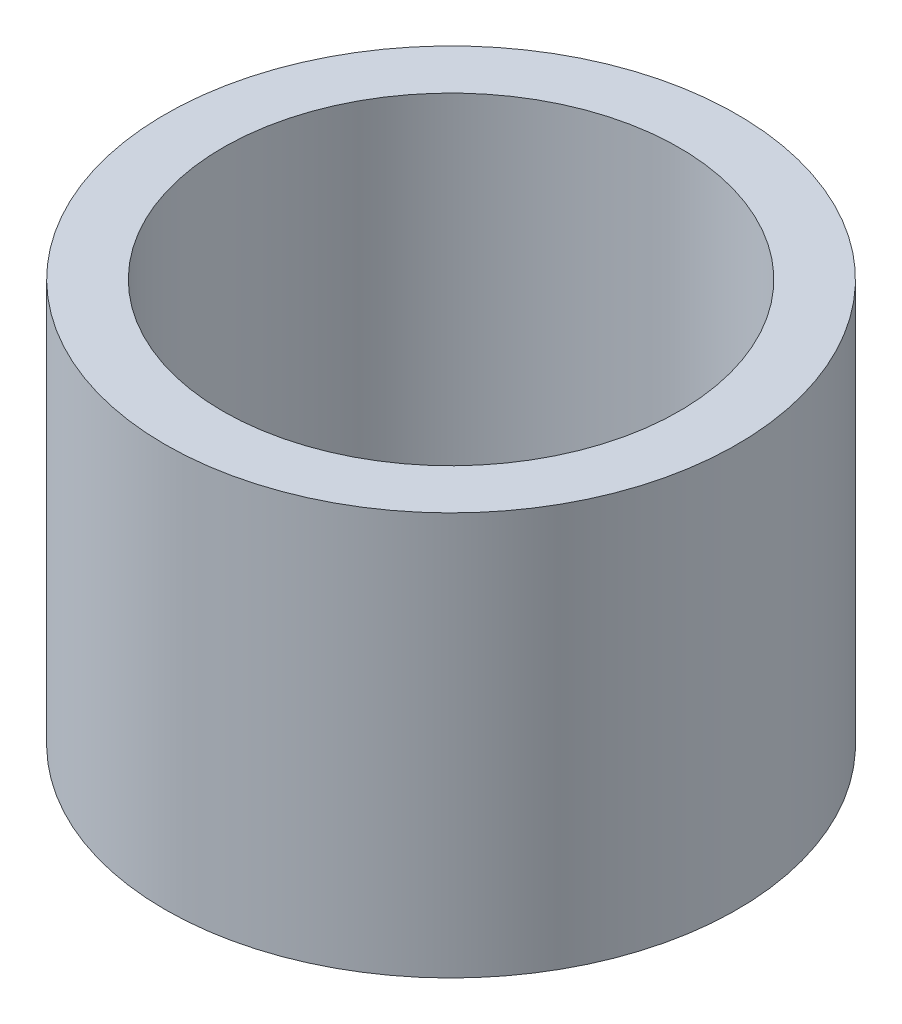
from build123d import *

# Parameters (mm, degrees)
SKETCH1_R      = 54.102
SKETCH1_R_2    = 43.18
ABLATIVE_DEPTH = 76.2


with BuildPart() as part:
    # Sketch1 → Ablative (new body)
    with BuildSketch(Plane(origin=(0, 0, 0), x_dir=(1, 0, 0), z_dir=(0, 1, 0))):
        Circle(SKETCH1_R)
        Circle(SKETCH1_R_2, mode=Mode.SUBTRACT)
    extrude(amount=-ABLATIVE_DEPTH)


solid = part.part
